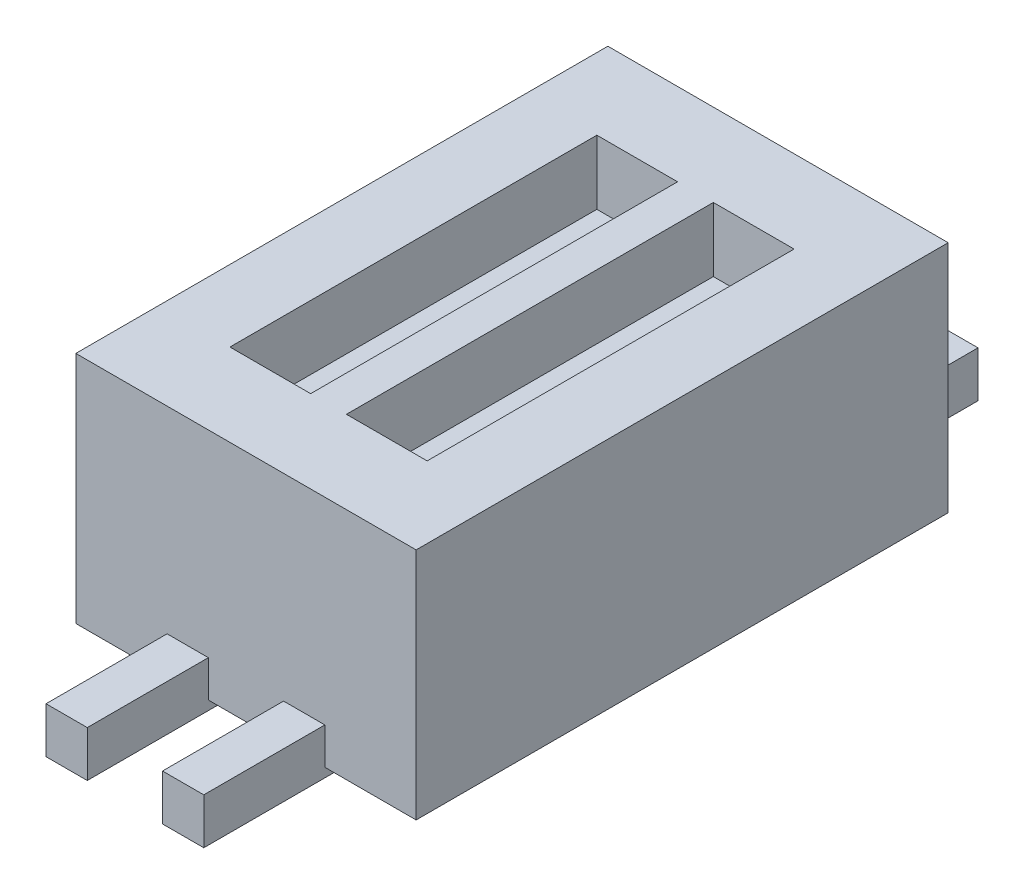
from build123d import *

# Parameters (mm, degrees)
BOSS_EXTRUDE1_START = 0.1
SKETCH1_W           = 3.71
SKETCH1_H           = 5.8
BOSS_EXTRUDE1_DEPTH = 2.55
SKETCH2_W           = 0.45
SKETCH2_H           = 1.82
BOSS_EXTRUDE2_DEPTH = 0.5
SKETCH3_W           = 0.88
SKETCH3_H           = 4
CUT_EXTRUDE1_DEPTH  = 0.7


with BuildPart() as part:
    # Sketch1 → Boss-Extrude1 (new body)
    with BuildSketch(Plane(origin=(0, 0, 0), x_dir=(1, 0, 0), z_dir=(0, 1, 0)).offset(BOSS_EXTRUDE1_START)):
        Rectangle(SKETCH1_W, SKETCH1_H)
    extrude(amount=BOSS_EXTRUDE1_DEPTH)

    # Sketch2 → Boss-Extrude2 (add)
    with BuildSketch(Plane(origin=(0, 0, 0), x_dir=(1, 0, 0), z_dir=(0, 1, 0))):
        with Locations((0.635, -3.31)):
            Rectangle(SKETCH2_W, SKETCH2_H)
        with Locations((-0.635, -3.31)):
            Rectangle(SKETCH2_W, SKETCH2_H)
        with Locations((-0.635, 3.31)):
            Rectangle(SKETCH2_W, SKETCH2_H)
        with Locations((0.635, 3.31)):
            Rectangle(SKETCH2_W, SKETCH2_H)
    extrude(amount=BOSS_EXTRUDE2_DEPTH)

    # Sketch3 → Cut-Extrude1 (cut)
    with BuildSketch(Plane(origin=(0, 2.65, 0), x_dir=(1, 0, 0), z_dir=(0, 1, 0))):
        with Locations((-0.635, 0)):
            Rectangle(SKETCH3_W, SKETCH3_H)
        with Locations((0.635, 0)):
            Rectangle(SKETCH3_W, SKETCH3_H)
    extrude(amount=-CUT_EXTRUDE1_DEPTH, mode=Mode.SUBTRACT)


solid = part.part
